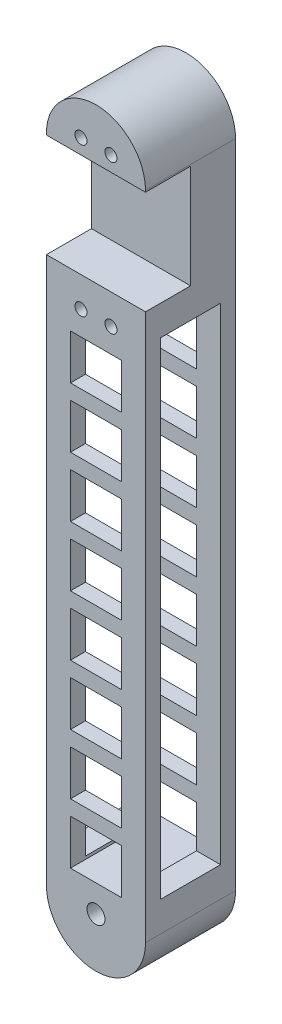
from build123d import *

# Parameters (mm, degrees)
SKETCH1_R           = 3
SKETCH1_R_2         = 2
BOSS_EXTRUDE2_DEPTH = 30
SKETCH1_4_R         = 4
CUT_EXTRUDE1_DEPTH  = 39
SKETCH1_5_R         = 9.5
SKETCH1_5_R_2       = 4
CUT_EXTRUDE2_DEPTH  = 6
SKETCH3_W           = 38.691948064
SKETCH3_H           = 34.5
CUT_EXTRUDE5_DEPTH  = 15
SKETCH4_W           = 17
SKETCH4_H           = 15
CUT_EXTRUDE6_DEPTH  = 33
SKETCH6_W           = 20
SKETCH6_H           = 162
CUT_EXTRUDE7_DEPTH  = 33


with BuildPart() as part:
    # Sketch1 → Boss-Extrude2 (new body)
    with BuildSketch(Plane.XY):
        with BuildLine():
            Line((-16.5, 175.114767993), (-16.5, -41.885232007))
            ThreePointArc((-16.5, -41.885232007), (0, -58.385232007), (16.5, -41.885232007))
            Line((16.5, -41.885232007), (16.5, 175.114767993))
            ThreePointArc((16.5, 175.114767993), (0, 191.614767993), (-16.5, 175.114767993))
        make_face()
        with Locations((0, -41.885232007)):
            Circle(SKETCH1_R, mode=Mode.SUBTRACT)
        with Locations((-5, 130.114767993)):
            Circle(SKETCH1_R_2, mode=Mode.SUBTRACT)
        with Locations((-5, 179.614767993)):
            Circle(SKETCH1_R_2, mode=Mode.SUBTRACT)
        with Locations((5, 130.114767993)):
            Circle(SKETCH1_R_2, mode=Mode.SUBTRACT)
        with Locations((5, 179.614767993)):
            Circle(SKETCH1_R_2, mode=Mode.SUBTRACT)
    extrude(amount=BOSS_EXTRUDE2_DEPTH)

    # Sketch1<4> → Cut-Extrude1 (cut)
    with BuildSketch(Plane.XY):
        with Locations((0, 165.114767993)):
            Circle(SKETCH1_4_R)
    extrude(amount=CUT_EXTRUDE1_DEPTH, mode=Mode.SUBTRACT)

    # Sketch1<5> → Cut-Extrude2 (cut)
    with BuildSketch(Plane.XY):
        with Locations((0, 165.114767993)):
            Circle(SKETCH1_5_R)
        with Locations((0, 165.114767993)):
            Circle(SKETCH1_5_R_2, mode=Mode.SUBTRACT)
    extrude(amount=CUT_EXTRUDE2_DEPTH, mode=Mode.SUBTRACT)

    # Sketch3 → Cut-Extrude5 (cut)
    with BuildSketch(Plane.XY.offset(30)):
        with Locations((0.226361627, 157.364767993)):
            Rectangle(SKETCH3_W, SKETCH3_H)
    extrude(amount=-CUT_EXTRUDE5_DEPTH, mode=Mode.SUBTRACT)

    # Sketch4 → Cut-Extrude6 (cut)
    with BuildSketch(Plane.XY.offset(30)):
        with Locations((0, 114.614767993)):
            Rectangle(SKETCH4_W, SKETCH4_H)
        with Locations((0, 94.614767993)):
            Rectangle(SKETCH4_W, SKETCH4_H)
        with Locations((0, 74.614767993)):
            Rectangle(SKETCH4_W, SKETCH4_H)
        with Locations((0, 54.614767993)):
            Rectangle(SKETCH4_W, SKETCH4_H)
        with Locations((0, 34.614767993)):
            Rectangle(SKETCH4_W, SKETCH4_H)
        with Locations((0, 14.614767993)):
            Rectangle(SKETCH4_W, SKETCH4_H)
        with Locations((0, -5.385232007)):
            Rectangle(SKETCH4_W, SKETCH4_H)
        with Locations((0, -25.385232007)):
            Rectangle(SKETCH4_W, SKETCH4_H)
    extrude(amount=-CUT_EXTRUDE6_DEPTH, mode=Mode.SUBTRACT)

    # Sketch6 → Cut-Extrude7 (cut)
    with BuildSketch(Plane(origin=(16.5, 0, 0), x_dir=(0, 0, -1), z_dir=(1, 0, 0))):
        with Locations((-15, 49.114767993)):
            Rectangle(SKETCH6_W, SKETCH6_H)
    extrude(amount=-CUT_EXTRUDE7_DEPTH, mode=Mode.SUBTRACT)


solid = part.part
